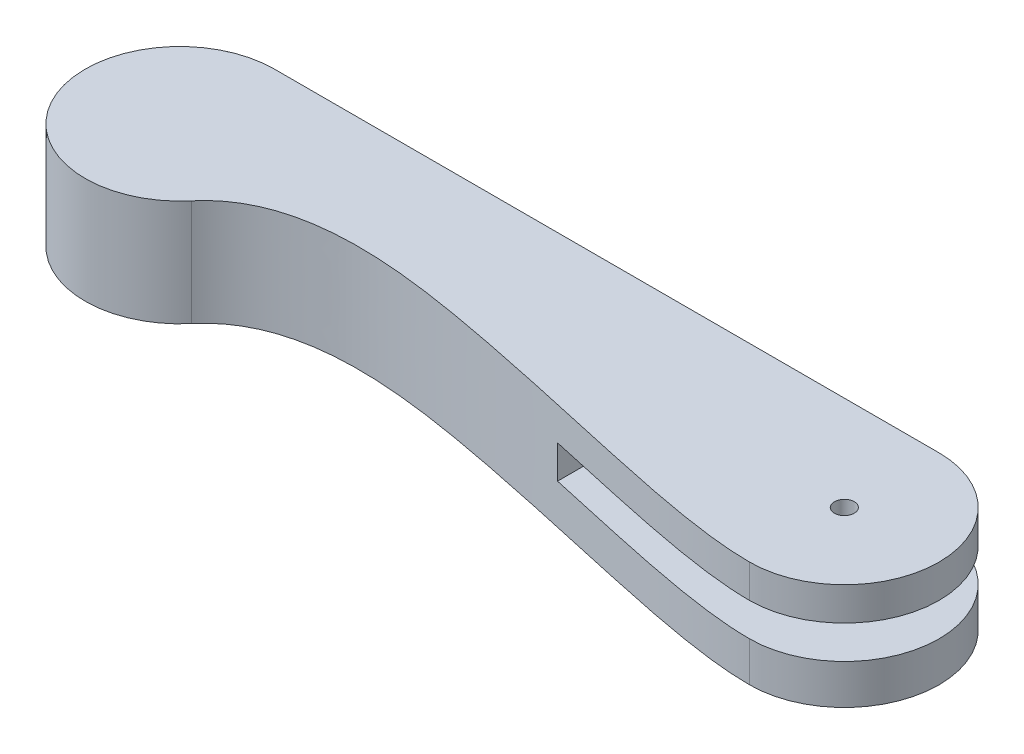
from build123d import *

# Parameters (mm, degrees)
BOSS_EXTRUDE1_DEPTH = 6
CUT_EXTRUDE1_REACH  = 68.084
SKETCH2_R           = 2.5
SKETCH3_R           = 1.5
CUT_EXTRUDE2_DEPTH  = 67.08422656
BOSS_EXTRUDE2_DEPTH = 5
BOSS_EXTRUDE3_DEPTH = 5
CUT_EXTRUDE3_REACH  = 69.728
SKETCH6_R           = 1.5
CUT_EXTRUDE4_REACH  = 69.728


with BuildPart() as part:
    # Sketch1 → Boss-Extrude1 (new body)
    with BuildSketch(Plane(origin=(0, 0, 0), x_dir=(1, 0, 0), z_dir=(0, 1, 0))):
        with BuildLine():
            Line((-50, 14.25), (50, 14.25))
            ThreePointArc((50, 14.25), (64.25, 0), (50, -14.25))
            Line((50, -14.25), (-50, -14.25))
            ThreePointArc((-50, -14.25), (-64.25, 0), (-50, 14.25))
        make_face()
    extrude(amount=BOSS_EXTRUDE1_DEPTH)

    # Sketch2 → Cut-Extrude1 (cut, up to next)
    with BuildSketch(Plane(origin=(0, 6, 0), x_dir=(1, 0, 0), z_dir=(0, 1, 0)), mode=Mode.PRIVATE) as cut_extrude1_sk1:
        with Locations(Location((-50, 8.25, 0), (0, 0, 270))):
            Circle(SKETCH2_R)
    cut_extrude1_tool1 = extrude(cut_extrude1_sk1.sketch, amount=-CUT_EXTRUDE1_REACH, mode=Mode.PRIVATE) & part.part
    # Sketch2 → Cut-Extrude1 (cut, up to next)
    with BuildSketch(Plane(origin=(0, 6, 0), x_dir=(1, 0, 0), z_dir=(0, 1, 0)), mode=Mode.PRIVATE) as cut_extrude1_sk2:
        with Locations(Location((-50, -8.25, 0), (0, 0, 270))):
            Circle(SKETCH2_R)
    cut_extrude1_tool2 = extrude(cut_extrude1_sk2.sketch, amount=-CUT_EXTRUDE1_REACH, mode=Mode.PRIVATE) & part.part
    add(cut_extrude1_tool1.solids().sort_by_distance((-50, 6, -8.25))[0], mode=Mode.SUBTRACT)
    add(cut_extrude1_tool2.solids().sort_by_distance((-50, 6, 8.25))[0], mode=Mode.SUBTRACT)

    # Sketch3 → Cut-Extrude2 (cut, through all)
    with BuildSketch(Plane.XZ):
        with Locations(Location((50, 0, 0), (0, 0, 270))):
            Circle(SKETCH3_R)
    extrude(amount=-CUT_EXTRUDE2_DEPTH, mode=Mode.SUBTRACT)

    # Sketch4 → Boss-Extrude2 (add)
    with BuildSketch(Plane(origin=(0, 6, 0), x_dir=(1, 0, 0), z_dir=(0, 1, 0))):
        with BuildLine():
            Line((-50, 14.25), (15, 14.25))
            Line((15, 14.25), (15, -14.25))
            Line((15, -14.25), (-50, -14.25))
            ThreePointArc((-50, -14.25), (-64.25, 0), (-50, 14.25))
        make_face()
    extrude(amount=BOSS_EXTRUDE2_DEPTH)

    # Sketch5 → Boss-Extrude3 (add)
    with BuildSketch(Plane(origin=(0, 11, 0), x_dir=(1, 0, 0), z_dir=(0, 1, 0))):
        with BuildLine():
            Line((-50, 14.25), (50, 14.25))
            ThreePointArc((50, 14.25), (64.25, 0), (50, -14.25))
            Line((50, -14.25), (-50, -14.25))
            ThreePointArc((-50, -14.25), (-64.25, 0), (-50, 14.25))
        make_face()
    extrude(amount=BOSS_EXTRUDE3_DEPTH)

    # Sketch6 → Cut-Extrude3 (cut, up to next)
    with BuildSketch(Plane(origin=(0, 16, 0), x_dir=(1, 0, 0), z_dir=(0, 1, 0)), mode=Mode.PRIVATE) as cut_extrude3_sk1:
        with Locations(Location((50, 0, 0), (0, 0, 90))):
            Circle(SKETCH6_R)
    cut_extrude3_tool1 = extrude(cut_extrude3_sk1.sketch, amount=-CUT_EXTRUDE3_REACH, mode=Mode.PRIVATE) & part.part
    add(cut_extrude3_tool1.solids().sort_by_distance((50, 16, 0))[0], mode=Mode.SUBTRACT)

    # Sketch7 → Cut-Extrude4 (cut, up to next)
    with BuildSketch(Plane(origin=(0, 16, 0), x_dir=(1, 0, 0), z_dir=(0, 1, 0)), mode=Mode.PRIVATE) as cut_extrude4_sk1:
        with BuildLine():
            ThreePointArc((-39.07315683, -9.146944754), (-43.970135273, -12.911360555), (-50, -14.25))
            Line((-50, -14.25), (50, -14.25))
            add(Edge.make_bspline(
                [(-39.07315683, -9.146944754), (-31.514094033, -0.116968526), (5.438655837, -4.645240543), (38.697514387, -14.25), (50, -14.25)],
                knots=[0, 0, 0, 0, 0.435907903, 1, 1, 1, 1], degree=3))
        make_face()
    cut_extrude4_tool1 = extrude(cut_extrude4_sk1.sketch, amount=-CUT_EXTRUDE4_REACH, mode=Mode.PRIVATE) & part.part
    add(cut_extrude4_tool1.solids().sort_by_distance((-8.590717, 16, 9.791359))[0], mode=Mode.SUBTRACT)


solid = part.part
